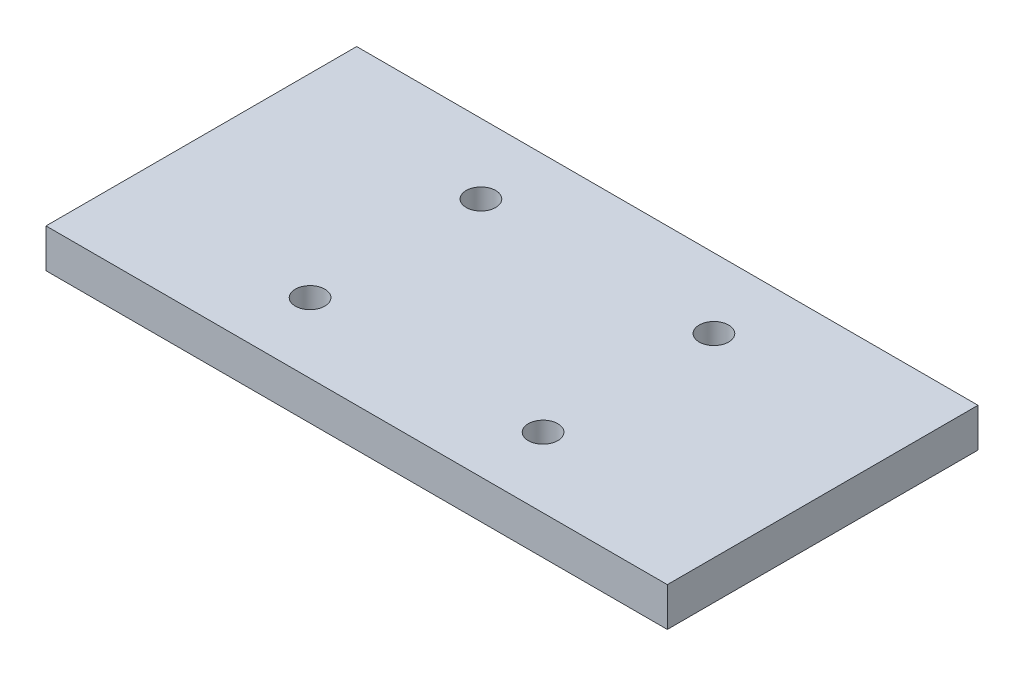
from build123d import *

# Parameters (mm, degrees)
SKETCH1_W                                       = 101.6
SKETCH1_H                                       = 50.8
BOSS_EXTRUDE1_DEPTH                             = 6.35
CSK_FOR_10_FLAT_HEAD_MACHINE_SCREW1_D           = 4.826
CSK_FOR_10_FLAT_HEAD_MACHINE_SCREW1_CSINK_D     = 9.525
CSK_FOR_10_FLAT_HEAD_MACHINE_SCREW1_CSINK_ANGLE = 82


with BuildPart() as part:
    # Sketch1 → Boss-Extrude1 (new body)
    with BuildSketch(Plane(origin=(0, 0, 0), x_dir=(1, 0, 0), z_dir=(0, 1, 0))):
        Rectangle(SKETCH1_W, SKETCH1_H)
    extrude(amount=BOSS_EXTRUDE1_DEPTH)

    # CSK for #10 Flat Head Machine Screw1 (through all)
    with Locations(Plane(origin=(0, 0, 0), x_dir=(-1, 0, 0), z_dir=(0, -1, 0))):
        with Locations((19.05, -13.97), (-19.05, -13.97), (-19.05, 13.97), (19.05, 13.97)):
            CounterSinkHole(CSK_FOR_10_FLAT_HEAD_MACHINE_SCREW1_D / 2, CSK_FOR_10_FLAT_HEAD_MACHINE_SCREW1_CSINK_D / 2, counter_sink_angle=CSK_FOR_10_FLAT_HEAD_MACHINE_SCREW1_CSINK_ANGLE)


solid = part.part
